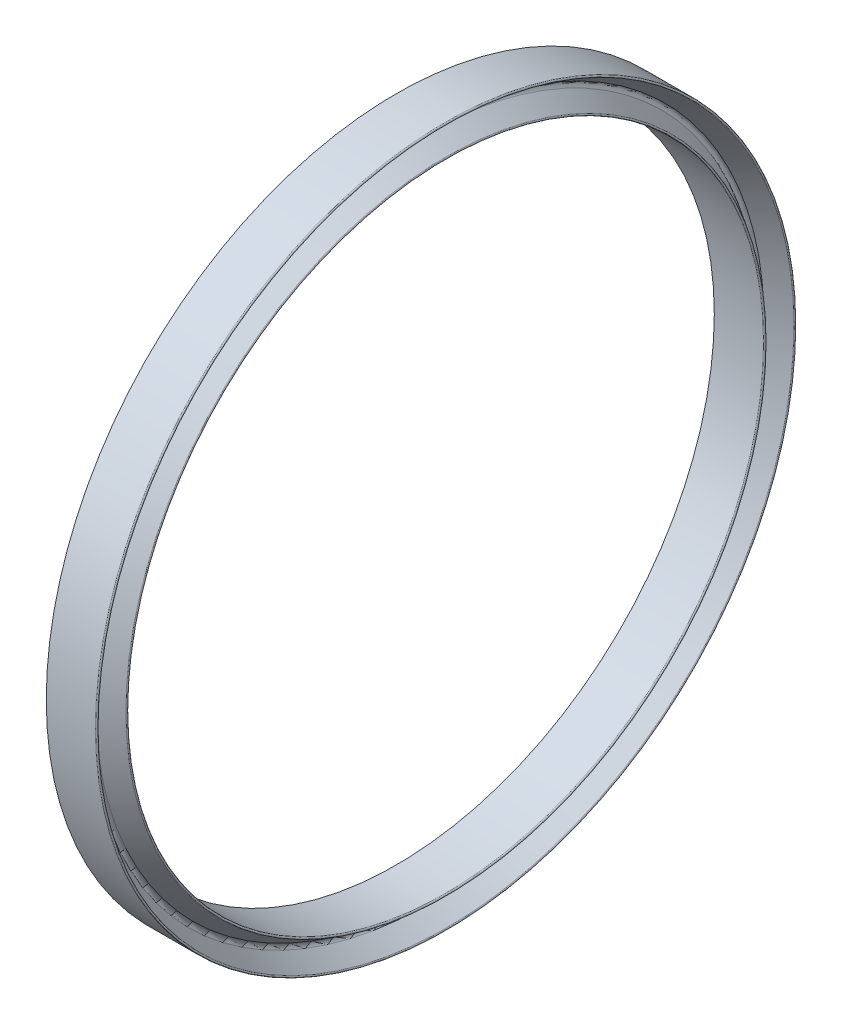
from build123d import *


with BuildPart() as part:
    # Sketch1 → Revolve1 (revolve)
    with BuildSketch(Plane.XY, mode=Mode.PRIVATE) as revolve1_sk:
        with BuildLine():
            Line((-65.199110398, -33), (-60.560142127, -33))
            ThreePointArc((-60.560142127, -33), (-60.463770635, -32.926693358), (-60.508692552, -32.814250707))
            Line((-60.508692552, -32.814250707), (-62.270363935, -31.757247878))
            ThreePointArc((-62.270363935, -31.757247878), (-62.416015208, -31.5), (-62.270363935, -31.242752122))
            Line((-62.270363935, -31.242752122), (-60.508692552, -30.185749293))
            ThreePointArc((-60.508692552, -30.185749293), (-60.463770635, -30.073306642), (-60.560142127, -30))
            Line((-60.560142127, -30), (-65.199110398, -30))
            Line((-65.199110398, -30), (-65.199110398, -33))
        make_face()
    revolve(revolve1_sk.sketch.rotate(Axis((-81.305330835, 0, 0), (1, 0, 0)), 270), axis=Axis((-81.305330835, 0, 0), (1, 0, 0)))


solid = part.part
